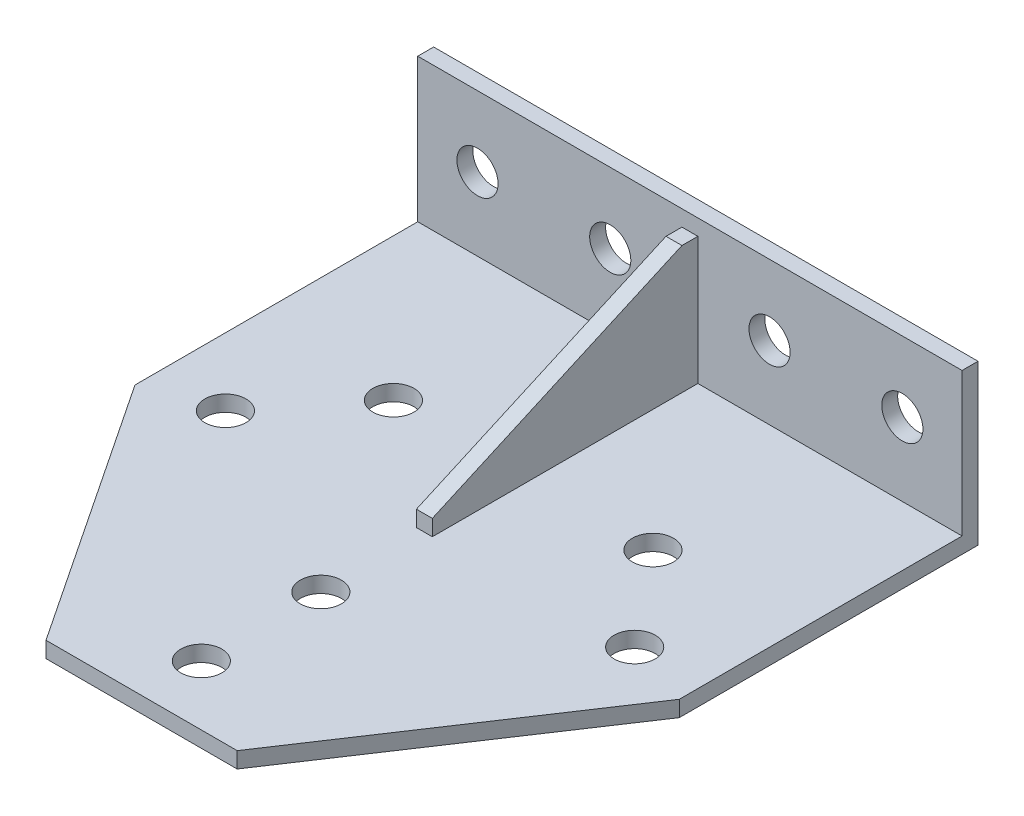
from build123d import *

# Parameters (mm, degrees)
SKETCH1_W      = 410
SKETCH1_H      = 120
SKETCH1_R      = 15.5
EXTRUDE1_DEPTH = 12
SKETCH2_W      = 410
SKETCH2_H      = 12
EXTRUDE2_DEPTH = 413
SKETCH3_R      = 15.5
EXTRUDE3_DEPTH = 413
SKETCH4_W      = 12
SKETCH4_H      = 96
EXTRUDE4_DEPTH = 200
EXTRUDE5_DEPTH = 200


with BuildPart() as part:
    # Sketch1 → Extrude1 (new body)
    with BuildSketch(Plane.XY):
        with Locations((205, 60)):
            Rectangle(SKETCH1_W, SKETCH1_H)
        with Locations((45, 67)):
            Circle(SKETCH1_R, mode=Mode.SUBTRACT)
        with Locations((145, 67)):
            Circle(SKETCH1_R, mode=Mode.SUBTRACT)
        with Locations((265, 67)):
            Circle(SKETCH1_R, mode=Mode.SUBTRACT)
        with Locations((365, 67)):
            Circle(SKETCH1_R, mode=Mode.SUBTRACT)
    extrude(amount=EXTRUDE1_DEPTH)

    # Sketch2 → Extrude2 (add)
    with BuildSketch(Plane.XY.offset(12)):
        with Locations((205, 6)):
            Rectangle(SKETCH2_W, SKETCH2_H)
    extrude(amount=EXTRUDE2_DEPTH)

    # Sketch3 → Extrude3 (cut)
    with BuildSketch(Plane(origin=(0, 12, 0), x_dir=(1, 0, 0), z_dir=(0, 1, 0))):
        with Locations(Location((302.738221798, -137.586347917, 0), (0, 0, 270))):
            Circle(SKETCH3_R)
        with Locations(Location((359.125657451, -207.732317869, 0), (0, 0, 270))):
            Circle(SKETCH3_R)
        with Locations(Location((107.261778202, -137.586347917, 0), (0, 0, 270))):
            Circle(SKETCH3_R)
        with Locations(Location((50.874342549, -207.732317869, 0), (0, 0, 270))):
            Circle(SKETCH3_R)
        with Locations(Location((205, -380, 0), (0, 0, 270))):
            Circle(SKETCH3_R)
        with Locations(Location((205, -290, 0), (0, 0, 270))):
            Circle(SKETCH3_R)
        Polygon((0, -425), (133, -425), (0, -225), align=None)
        Polygon((410, -425), (277, -425), (410, -225), align=None)
    extrude(amount=-EXTRUDE3_DEPTH, mode=Mode.SUBTRACT)

    # Sketch4 → Extrude4 (add)
    with BuildSketch(Plane.XY.offset(12)):
        with Locations((205, 60)):
            Rectangle(SKETCH4_W, SKETCH4_H)
    extrude(amount=EXTRUDE4_DEPTH)

    # Sketch5 → Extrude5 (cut)
    with BuildSketch(Plane.ZY.offset(-199)):
        Polygon((212, 108), (212, 24), (24, 108), align=None)
    extrude(amount=-EXTRUDE5_DEPTH, mode=Mode.SUBTRACT)


solid = part.part
